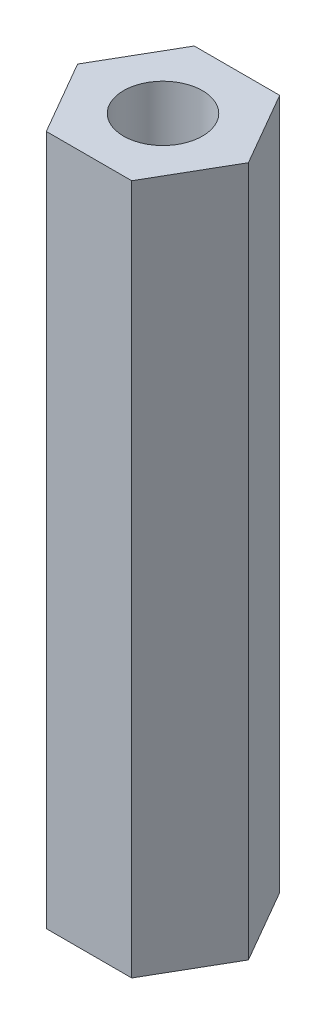
from build123d import *

# Parameters (mm, degrees)
SKETCH1_R           = 2
BOSS_EXTRUDE1_DEPTH = 35


with BuildPart() as part:
    # Sketch1 → Boss-Extrude1 (new body)
    with BuildSketch(Plane(origin=(0, 0, 0), x_dir=(1, 0, 0), z_dir=(0, 1, 0))):
        Polygon((2.165063509, 3.75), (-2.165063509, 3.75), (-4.330127019, 0), (-2.165063509, -3.75), (2.165063509, -3.75), (4.330127019, 0), align=None)
        with Locations(Location((0, 0, 0), (0, 0, 270))):
            Circle(SKETCH1_R, mode=Mode.SUBTRACT)
    extrude(amount=BOSS_EXTRUDE1_DEPTH)


solid = part.part
